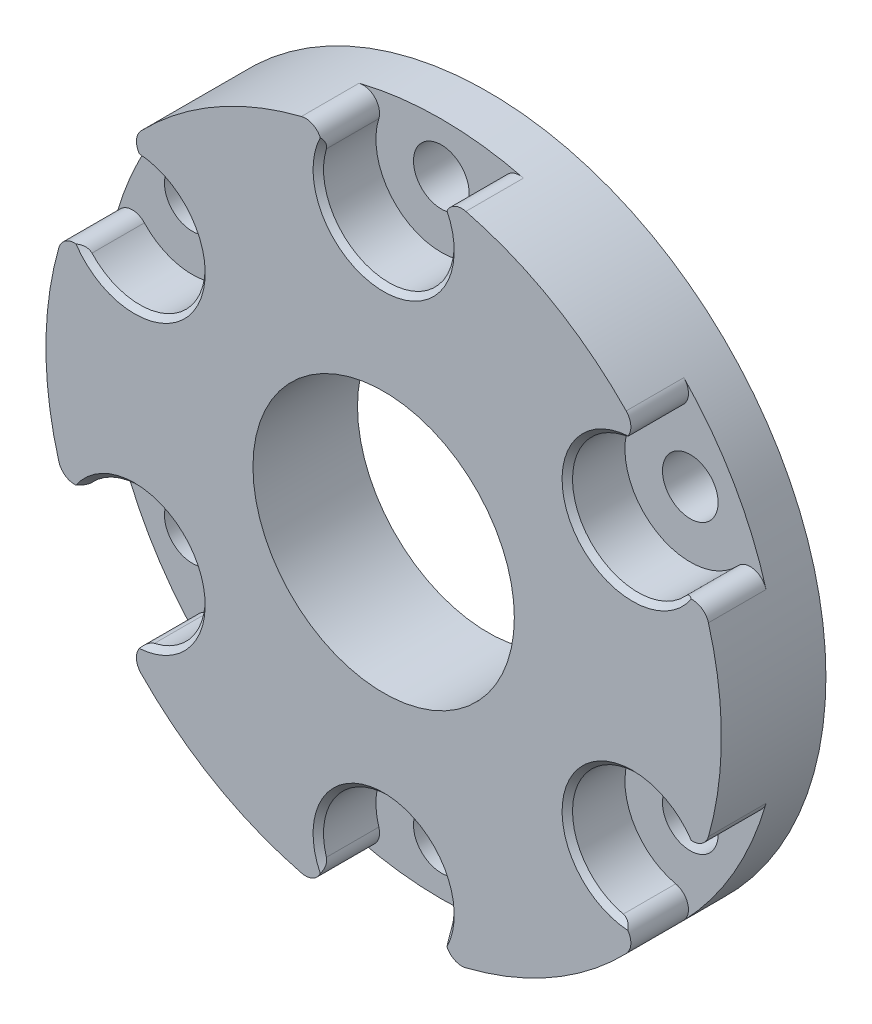
from build123d import *

# Parameters (mm, degrees)
SKETCH1_R                                   = 41.021
SKETCH1_R_2                                 = 3.175
SKETCH1_R_3                                 = 15.875
BOSS_EXTRUDE1_DEPTH                         = 6.35
CBORE_FOR_1_4_HEX_MACHINE_SCREW1_AT_2_COUNT = 2
CBORE_FOR_1_4_HEX_MACHINE_SCREW1_AT_2_PITCH = 34.925
CBORE_FOR_1_4_HEX_MACHINE_SCREW1_AT_3_COUNT = 2
CBORE_FOR_1_4_HEX_MACHINE_SCREW1_AT_3_PITCH = 60.491874454
CBORE_FOR_1_4_HEX_MACHINE_SCREW1_AT_4_COUNT = 2
CBORE_FOR_1_4_HEX_MACHINE_SCREW1_AT_4_PITCH = 69.85
CBORE_FOR_1_4_HEX_MACHINE_SCREW1_AT_5_COUNT = 2
CBORE_FOR_1_4_HEX_MACHINE_SCREW1_AT_5_PITCH = 60.491874454
CBORE_FOR_1_4_HEX_MACHINE_SCREW1_AT_6_COUNT = 2
CBORE_FOR_1_4_HEX_MACHINE_SCREW1_AT_6_PITCH = 34.925
FILLET1_R                                   = 2


with BuildPart() as part:
    # Sketch1 → Boss-Extrude1 (new, symmetric)
    with BuildSketch(Plane.XY):
        Circle(SKETCH1_R)
        with Locations((0, 34.925)):
            Circle(SKETCH1_R_2, mode=Mode.SUBTRACT)
        with Locations((30.245937227, 17.4625)):
            Circle(SKETCH1_R_2, mode=Mode.SUBTRACT)
        with Locations((30.245937227, -17.4625)):
            Circle(SKETCH1_R_2, mode=Mode.SUBTRACT)
        with Locations((0, -34.925)):
            Circle(SKETCH1_R_2, mode=Mode.SUBTRACT)
        with Locations((-30.245937227, -17.4625)):
            Circle(SKETCH1_R_2, mode=Mode.SUBTRACT)
        with Locations((-30.245937227, 17.4625)):
            Circle(SKETCH1_R_2, mode=Mode.SUBTRACT)
        Circle(SKETCH1_R_3, mode=Mode.SUBTRACT)
    extrude(amount=BOSS_EXTRUDE1_DEPTH, both=True)

    # Sketch9 → CBORE for 1/4 Hex Machine Screw1 (revolve, cut)
    with BuildSketch(Plane(origin=(-30.245937227, -17.4625, 6.35), x_dir=(0, -1, 0), z_dir=(1, 0, 0))):
        Polygon((0, 0), (0, 12.7), (3.3782, 12.7), (3.3782, 6.99999997), (7.9375, 6.99999997), (7.9375, 0.635), (8.5725, 0), align=None)
    cbore_for_1_4_hex_machine_screw1 = revolve(axis=Axis((-30.245937227, -17.4625, 12.7), (0, 0, -1)), mode=Mode.SUBTRACT)

    # CBORE for 1/4 Hex Machine Screw1 at 2: CBORE for 1/4 Hex Machine Screw1 ×2
    with Locations(*[Vector(0.8660254037844388, -0.4999999999999998, 0) * (i * CBORE_FOR_1_4_HEX_MACHINE_SCREW1_AT_2_PITCH) for i in range(1, CBORE_FOR_1_4_HEX_MACHINE_SCREW1_AT_2_COUNT)]):
        add(cbore_for_1_4_hex_machine_screw1, mode=Mode.SUBTRACT)

    # CBORE for 1/4 Hex Machine Screw1 at 3: CBORE for 1/4 Hex Machine Screw1 ×2
    with Locations(*[(i * CBORE_FOR_1_4_HEX_MACHINE_SCREW1_AT_3_PITCH, 0, 0) for i in range(1, CBORE_FOR_1_4_HEX_MACHINE_SCREW1_AT_3_COUNT)]):
        add(cbore_for_1_4_hex_machine_screw1, mode=Mode.SUBTRACT)

    # CBORE for 1/4 Hex Machine Screw1 at 4: CBORE for 1/4 Hex Machine Screw1 ×2
    with Locations(*[Vector(0.8660254037844385, 0.5000000000000004, 0) * (i * CBORE_FOR_1_4_HEX_MACHINE_SCREW1_AT_4_PITCH) for i in range(1, CBORE_FOR_1_4_HEX_MACHINE_SCREW1_AT_4_COUNT)]):
        add(cbore_for_1_4_hex_machine_screw1, mode=Mode.SUBTRACT)

    # CBORE for 1/4 Hex Machine Screw1 at 5: CBORE for 1/4 Hex Machine Screw1 ×2
    with Locations(*[Vector(0.49999999999999983, 0.8660254037844388, 0) * (i * CBORE_FOR_1_4_HEX_MACHINE_SCREW1_AT_5_PITCH) for i in range(1, CBORE_FOR_1_4_HEX_MACHINE_SCREW1_AT_5_COUNT)]):
        add(cbore_for_1_4_hex_machine_screw1, mode=Mode.SUBTRACT)

    # CBORE for 1/4 Hex Machine Screw1 at 6: CBORE for 1/4 Hex Machine Screw1 ×2
    with Locations(*[(0, i * CBORE_FOR_1_4_HEX_MACHINE_SCREW1_AT_6_PITCH, 0) for i in range(1, CBORE_FOR_1_4_HEX_MACHINE_SCREW1_AT_6_COUNT)]):
        add(cbore_for_1_4_hex_machine_screw1, mode=Mode.SUBTRACT)

    # Fillet1
    fillet1_edges = [part.edges().sort_by_distance(p)[0] for p in [
        (37.953299503, -15.565008763, 2.532500015),
        (32.456342751, -25.086017146, 2.532500015),
        (5.496956752, -40.651025909, 2.532500015),
        (-5.496956752, -40.651025909, 2.532500015),
        (-32.456342751, -25.086017146, 2.532500015),
        (-37.953299503, -15.565008763, 2.532500015),
        (32.456342751, 25.086017146, 2.532500015),
        (37.953299503, 15.565008763, 2.532500015),
        (-5.496956752, 40.651025909, 2.532500015),
        (5.496956752, 40.651025909, 2.532500015),
        (-37.953299503, 15.565008763, 2.532500015),
        (-32.456342751, 25.086017146, 2.532500015),
    ]]
    fillet(fillet1_edges, radius=FILLET1_R)


solid = part.part
